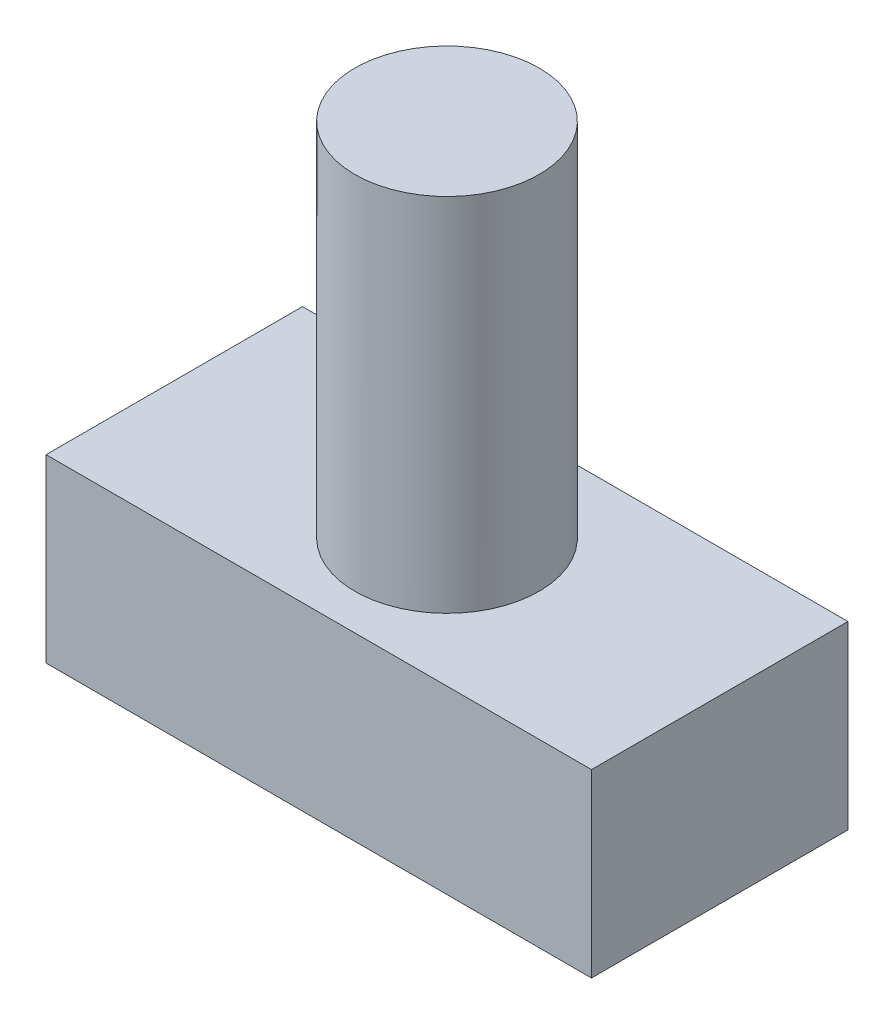
from build123d import *

# Parameters (mm, degrees)
SKETCH_2_W      = 302.180498412
SKETCH_2_H      = 142.083514116
EXTRUDE_1_DEPTH = 100
SKETCH_2_3_R    = 51.07818505
EXTRUDE_2_DEPTH = 300


with BuildPart() as part:
    # 草图2 → 凸台-拉伸1 (new body)
    with BuildSketch(Plane(origin=(0, 0, 0), x_dir=(1, 0, 0), z_dir=(0, 1, 0))):
        Rectangle(SKETCH_2_W, SKETCH_2_H)
    extrude(amount=EXTRUDE_1_DEPTH)

    # 草图2<3> → 凸台-拉伸2 (add)
    with BuildSketch(Plane(origin=(0, 0, 0), x_dir=(1, 0, 0), z_dir=(0, 1, 0))):
        Circle(SKETCH_2_3_R)
    extrude(amount=EXTRUDE_2_DEPTH)


solid = part.part
